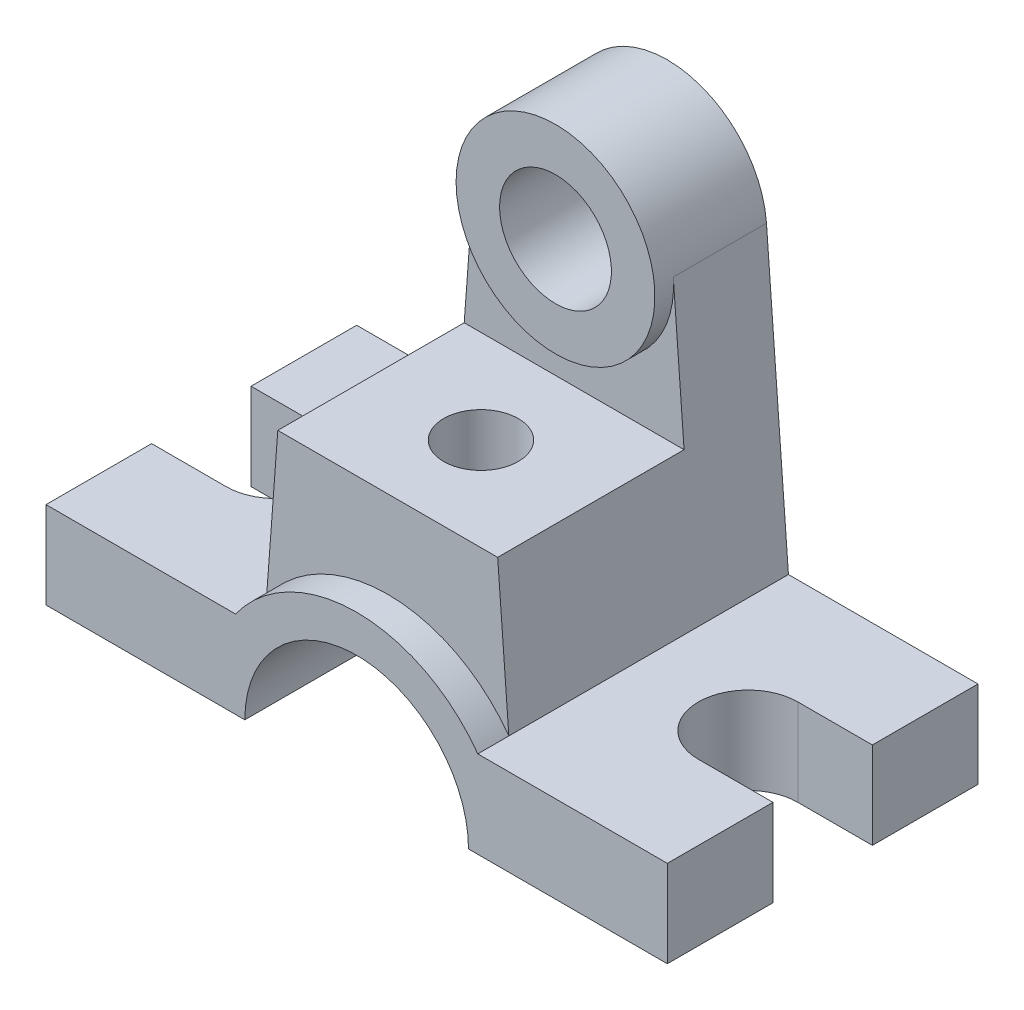
from build123d import *

# Parameters (mm, degrees)
EXTRUDE_1_DEPTH     = 50
CUT_EXTRUDE_1_DEPTH = 73.083285164
EXTRUDE_START       = -15
EXTRUDE_2_DEPTH     = 15
SKETCH_4_3_R        = 9
EXTRUDE_3_DEPTH     = 18
EXTRUDE_4_DEPTH     = 15
EXTRUDE_START_2     = -45
EXTRUDE_5_DEPTH     = 45
SKETCH_5_R          = 6
CUT_EXTRUDE_2_DEPTH = 81.274528962


with BuildPart() as part:
    # 草图1 → 凸台-拉伸1 (new body)
    with BuildSketch(Plane.XY):
        with BuildLine():
            Line((-50, 0), (-18, 0))
            ThreePointArc((-18, 0), (0, 18), (18, 0))
            Line((18, 0), (50, 0))
            Line((50, 0), (50, 14))
            Line((50, 14), (19.49358869, 14))
            ThreePointArc((19.49358869, 14), (0, 24), (-19.49358869, 14))
            Line((-19.49358869, 14), (-50, 14))
            Line((-50, 14), (-50, 0))
        make_face()
    extrude(amount=-EXTRUDE_1_DEPTH)

    # 草图2 → 切除-拉伸1 (cut, through all)
    with BuildSketch(Plane(origin=(0, 14, 0), x_dir=(1, 0, 0), z_dir=(0, 1, 0))):
        with BuildLine():
            Line((-62, 33), (-38, 33))
            ThreePointArc((-38, 33), (-30, 25), (-38, 17))
            Line((-38, 17), (-62, 17))
            ThreePointArc((-62, 17), (-70, 25), (-62, 33))
        make_face()
        with BuildLine():
            Line((62, 33), (38, 33))
            ThreePointArc((38, 33), (30, 25), (38, 17))
            Line((38, 17), (62, 17))
            ThreePointArc((62, 17), (70, 25), (62, 33))
        make_face()
    extrude(amount=-CUT_EXTRUDE_1_DEPTH, mode=Mode.SUBTRACT)

    # 草图4 → 凸台-拉伸2 (add)
    with BuildSketch(Plane(origin=(0, 0, -50), x_dir=(-1, 0, 0), z_dir=(0, 0, -1)).offset(EXTRUDE_START)):
        with BuildLine():
            Line((-17.69427427, 38), (-19.49358869, 14))
            ThreePointArc((-19.49358869, 14), (0, 24), (19.49358869, 14))
            Line((19.49358869, 14), (17.69427427, 38))
            Line((17.69427427, 38), (-17.69427427, 38))
        make_face()
    extrude(amount=EXTRUDE_2_DEPTH)



with BuildPart() as body_2:
    # 草图4<3> → 凸台-拉伸3 (new body)
    with BuildSketch(Plane(origin=(0, 0, -50), x_dir=(-1, 0, 0), z_dir=(0, 0, -1))):
        with BuildLine():
            ThreePointArc((15.955222944, 61.196185946), (0, 76), (-15.955222944, 61.196185946))
            ThreePointArc((-15.955222944, 61.196185946), (-0.598511863, 44.011198183), (16, 60))
            ThreePointArc((16, 60), (15.988801817, 60.598511863), (15.955222944, 61.196185946))
        make_face()
        with Locations((0, 60)):
            Circle(SKETCH_4_3_R, mode=Mode.SUBTRACT)
    extrude(amount=-EXTRUDE_3_DEPTH)


with BuildPart() as part_1:
    add(part.part)

    add(body_2.part)  # 凸台-拉伸4 merges body 2
    # 草图4<4> → 凸台-拉伸4 (add)
    with BuildSketch(Plane(origin=(0, 0, -50), x_dir=(-1, 0, 0), z_dir=(0, 0, -1))):
        with BuildLine():
            Line((-17.69427427, 38), (17.69427427, 38))
            Line((17.69427427, 38), (15.955222944, 61.196185946))
            ThreePointArc((15.955222944, 61.196185946), (0, 44), (-15.955222944, 61.196185946))
            Line((-15.955222944, 61.196185946), (-17.69427427, 38))
        make_face()
    extrude(amount=-EXTRUDE_4_DEPTH)

    # 草图4<5> → 凸台-拉伸5 (add)
    with BuildSketch(Plane(origin=(0, 0, -50), x_dir=(-1, 0, 0), z_dir=(0, 0, -1)).offset(EXTRUDE_START_2)):
        with BuildLine():
            ThreePointArc((-19.49358869, 14), (0, 24), (19.49358869, 14))
            Line((19.49358869, 14), (17.69427427, 38))
            Line((17.69427427, 38), (-17.69427427, 38))
            Line((-17.69427427, 38), (-19.49358869, 14))
        make_face()
    extrude(amount=EXTRUDE_5_DEPTH)

    # 草图5 → 切除-拉伸2 (cut, through all)
    with BuildSketch(Plane(origin=(0, 38, 0), x_dir=(1, 0, 0), z_dir=(0, 1, 0))):
        with Locations((0, 20)):
            Circle(SKETCH_5_R)
    extrude(amount=-CUT_EXTRUDE_2_DEPTH, mode=Mode.SUBTRACT)


solid = part_1.part
